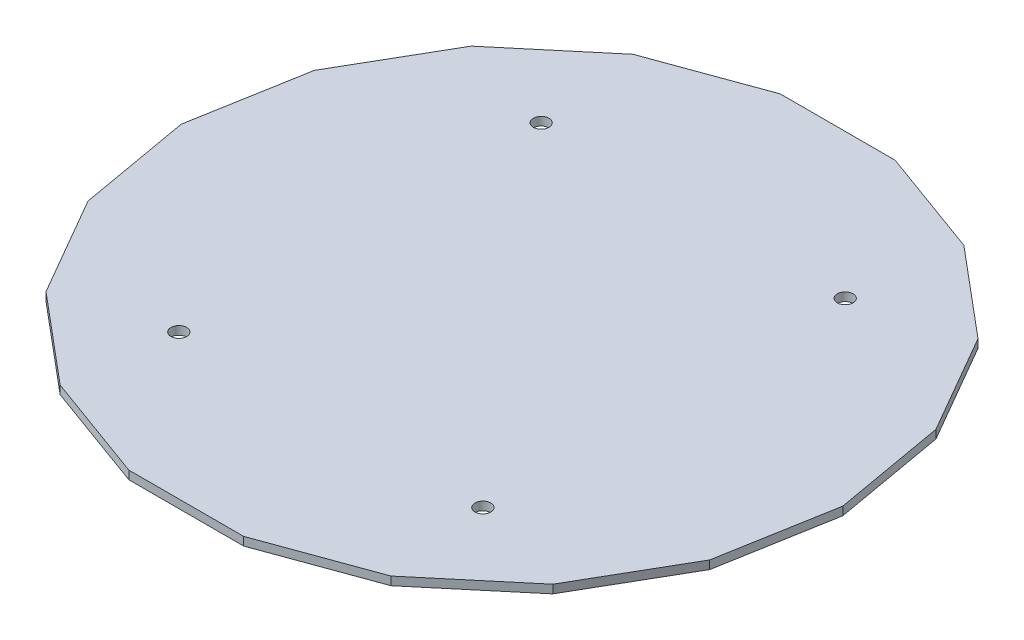
from build123d import *

# Parameters (mm, degrees)
BOSS_EXTRUDE1_DEPTH = 1.6
SKETCH7_R           = 1.5
CUT_EXTRUDE4_DEPTH  = 1.6


with BuildPart() as part:
    # Sketch1 → Boss-Extrude1 (new body)
    with BuildSketch(Plane(origin=(0, 0, 0), x_dir=(1, 0, 0), z_dir=(0, 1, 0))):
        Polygon((63, 0), (59.20063511, 21.54726903), (48.260799916, 40.49561941), (31.5, 54.559600438), (10.939835193, 62.04288844), (-10.939835193, 62.04288844), (-31.5, 54.559600438), (-48.260799916, 40.49561941), (-59.20063511, 21.54726903), (-63, 0), (-59.20063511, -21.54726903), (-48.260799916, -40.49561941), (-31.5, -54.559600438), (-10.939835193, -62.04288844), (10.939835193, -62.04288844), (31.5, -54.559600438), (48.260799916, -40.49561941), (59.20063511, -21.54726903), align=None)
    extrude(amount=BOSS_EXTRUDE1_DEPTH)

    # Sketch7 → Cut-Extrude4 (cut)
    with BuildSketch(Plane(origin=(0, 1.6, 0), x_dir=(1, 0, 0), z_dir=(0, 1, 0))):
        with Locations(Location((-28.953010594, 34.504854391, 0), (0, 0, 270))):
            Circle(SKETCH7_R)
        with Locations(Location((28.953010594, 34.504854391, 0), (0, 0, 270))):
            Circle(SKETCH7_R)
        with Locations(Location((-28.953010594, -34.504854391, 0), (0, 0, 270))):
            Circle(SKETCH7_R)
        with Locations(Location((28.953010594, -34.504854391, 0), (0, 0, 270))):
            Circle(SKETCH7_R)
    extrude(amount=-CUT_EXTRUDE4_DEPTH, mode=Mode.SUBTRACT)


solid = part.part
